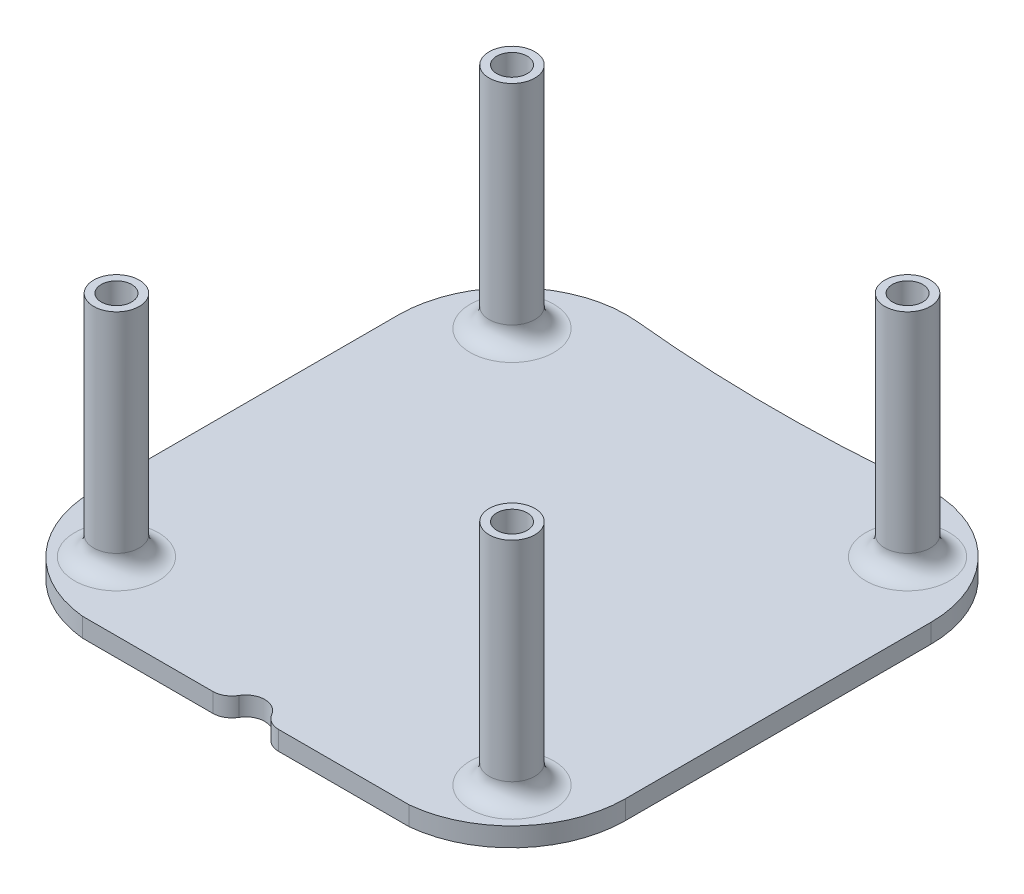
from build123d import *

# Parameters (mm, degrees)
BOSS_EXTRUDE1_DEPTH = 5
SKETCH3_R           = 6
SKETCH3_R_2         = 2
BOSS_EXTRUDE2_DEPTH = 60
SKETCH4_R           = 4
CUT_EXTRUDE2_DEPTH  = 20
FILLET1_R           = 5
SKETCH5_R           = 5
CUT_EXTRUDE3_DEPTH  = 10
FILLET2_R           = 5


with BuildPart() as part:
    # Sketch2 → Boss-Extrude1 (new body)
    with BuildSketch(Plane(origin=(0, 0, 0), x_dir=(1, 0, 0), z_dir=(0, 1, 0))):
        with BuildLine():
            Line((-53.508823352, -72.096737708), (32.436645713, -72.096737708))
            ThreePointArc((32.436645713, -72.096737708), (51.703313555, -62.379157363), (59.46391118, -42.24438689))
            Line((59.46391118, -42.24438689), (59.46391118, 38.050911473))
            ThreePointArc((59.46391118, 38.050911473), (50.695521882, 59.245691656), (29.51599738, 68.050866257))
            ThreePointArc((29.51599738, 68.050866257), (-9.019885151, 65.996186888), (-47.563354288, 67.903262292))
            ThreePointArc((-47.563354288, 67.903262292), (-70.670859293, 60.290313848), (-80.53608882, 38.050911473))
            Line((-80.53608882, 38.050911473), (-80.53608882, -42.24438689))
            ThreePointArc((-80.53608882, -42.24438689), (-72.775491194, -62.379157363), (-53.508823352, -72.096737708))
        make_face()
    extrude(amount=BOSS_EXTRUDE1_DEPTH)

    # Sketch3 → Boss-Extrude2 (add)
    # profile 1 of 4: a face of its own
    with BuildSketch(Plane(origin=(0, 5, 0), x_dir=(1, 0, 0), z_dir=(0, 1, 0))):
        with Locations(Location((41.46391118, 49.903262292, 0), (0, 0, 90))):
            Circle(SKETCH3_R)
        with Locations(Location((41.46391118, 49.903262292, 0), (0, 0, 270))):
            Circle(SKETCH3_R_2, mode=Mode.SUBTRACT)
    # profile 2 of 4: a face of its own
    with BuildSketch(Plane(origin=(0, 5, 0), x_dir=(1, 0, 0), z_dir=(0, 1, 0))):
        with Locations(Location((-62.53608882, 49.903262292, 0), (0, 0, 90))):
            Circle(SKETCH3_R)
        with Locations(Location((-62.53608882, 49.903262292, 0), (0, 0, 90))):
            Circle(SKETCH3_R_2, mode=Mode.SUBTRACT)
    # profile 3 of 4: a face of its own
    with BuildSketch(Plane(origin=(0, 5, 0), x_dir=(1, 0, 0), z_dir=(0, 1, 0))):
        with Locations(Location((-62.53608882, -54.096737708, 0), (0, 0, 90))):
            Circle(SKETCH3_R)
        with Locations(Location((-62.53608882, -54.096737708, 0), (0, 0, 270))):
            Circle(SKETCH3_R_2, mode=Mode.SUBTRACT)
    # profile 4 of 4: a face of its own
    with BuildSketch(Plane(origin=(0, 5, 0), x_dir=(1, 0, 0), z_dir=(0, 1, 0))):
        with Locations(Location((41.46391118, -54.096737708, 0), (0, 0, 90))):
            Circle(SKETCH3_R)
        with Locations(Location((41.46391118, -54.096737708, 0), (0, 0, 90))):
            Circle(SKETCH3_R_2, mode=Mode.SUBTRACT)
    extrude(amount=BOSS_EXTRUDE2_DEPTH)

    # Sketch4 → Cut-Extrude2 (cut)
    with BuildSketch(Plane(origin=(0, 65, 0), x_dir=(1, 0, 0), z_dir=(0, 1, 0))):
        with Locations(Location((41.46391118, 49.903262292, 0), (0, 0, 270))):
            Circle(SKETCH4_R)
        with Locations(Location((-62.53608882, 49.903262292, 0), (0, 0, 270))):
            Circle(SKETCH4_R)
        with Locations(Location((-62.53608882, -54.096737708, 0), (0, 0, 270))):
            Circle(SKETCH4_R)
        with Locations(Location((41.46391118, -54.096737708, 0), (0, 0, 270))):
            Circle(SKETCH4_R)
    extrude(amount=-CUT_EXTRUDE2_DEPTH, mode=Mode.SUBTRACT)

    # Fillet1
    fillet1_edges = [part.edges().sort_by_distance(p)[0] for p in [
        (41.46391118, 5, -43.903262292),
        (-62.53608882, 5, -43.903262292),
        (-62.53608882, 5, 60.096737708),
        (41.46391118, 5, 60.096737708),
    ]]
    fillet(fillet1_edges, radius=FILLET1_R)

    # Sketch5 → Cut-Extrude3 (cut)
    with BuildSketch(Plane(origin=(0, 5, 0), x_dir=(1, 0, 0), z_dir=(0, 1, 0))):
        with Locations((-10.53608882, -72.096737708)):
            Circle(SKETCH5_R)
    extrude(amount=-CUT_EXTRUDE3_DEPTH, mode=Mode.SUBTRACT)

    # Fillet2
    fillet2_edges = [part.edges().sort_by_distance(p)[0] for p in [
        (-15.53608882, 2.5, 72.096737708),
        (-5.53608882, 2.5, 72.096737708),
    ]]
    fillet(fillet2_edges, radius=FILLET2_R)


solid = part.part
